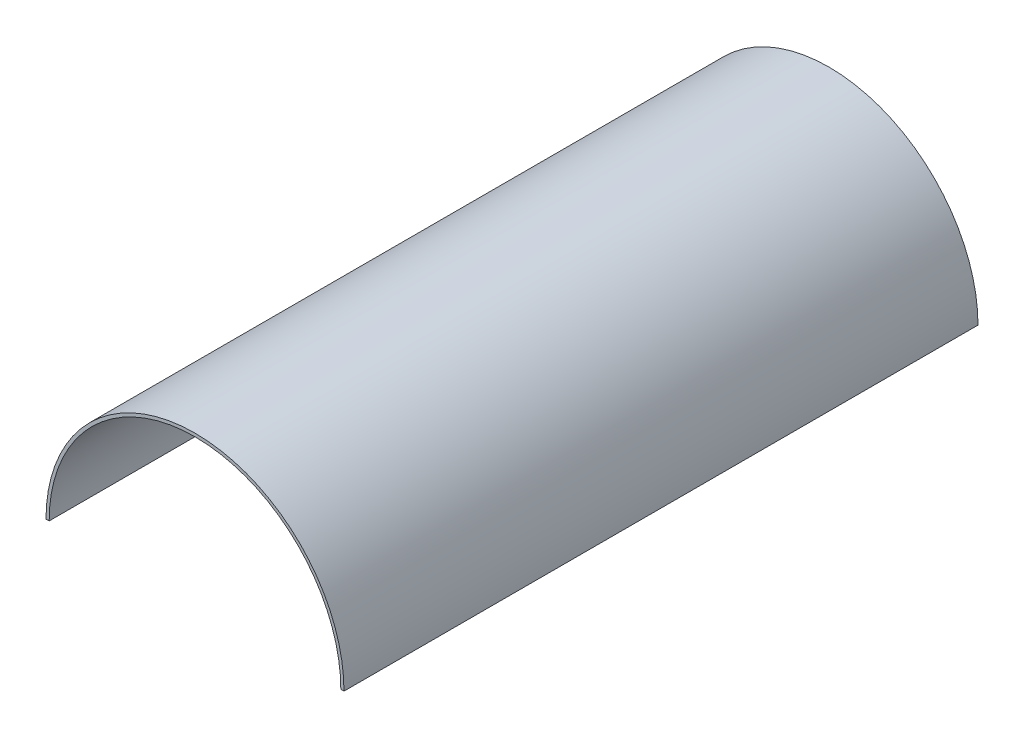
from build123d import *

# Parameters (mm, degrees)
CROQUIS1_R              = 23.5
CROQUIS1_R_2            = 23
SALIENTE_EXTRUIR1_DEPTH = 100
CROQUIS2_W              = 51.494552362
CROQUIS2_H              = 114.79268914
CORTAR_EXTRUIR1_DEPTH   = 106.377891419


with BuildPart() as part:
    # Croquis1 → Saliente-Extruir1 (new body)
    with BuildSketch(Plane.XY):
        Circle(CROQUIS1_R)
        Circle(CROQUIS1_R_2, mode=Mode.SUBTRACT)
    extrude(amount=SALIENTE_EXTRUIR1_DEPTH)

    # Croquis2 → Cortar-Extruir1 (cut, through all)
    with BuildSketch(Plane(origin=(0, 0, 0), x_dir=(1, 0, 0), z_dir=(0, 1, 0))):
        with Locations((0.341698611, -45.784167148)):
            Rectangle(CROQUIS2_W, CROQUIS2_H)
    extrude(amount=-CORTAR_EXTRUIR1_DEPTH, mode=Mode.SUBTRACT)


solid = part.part
